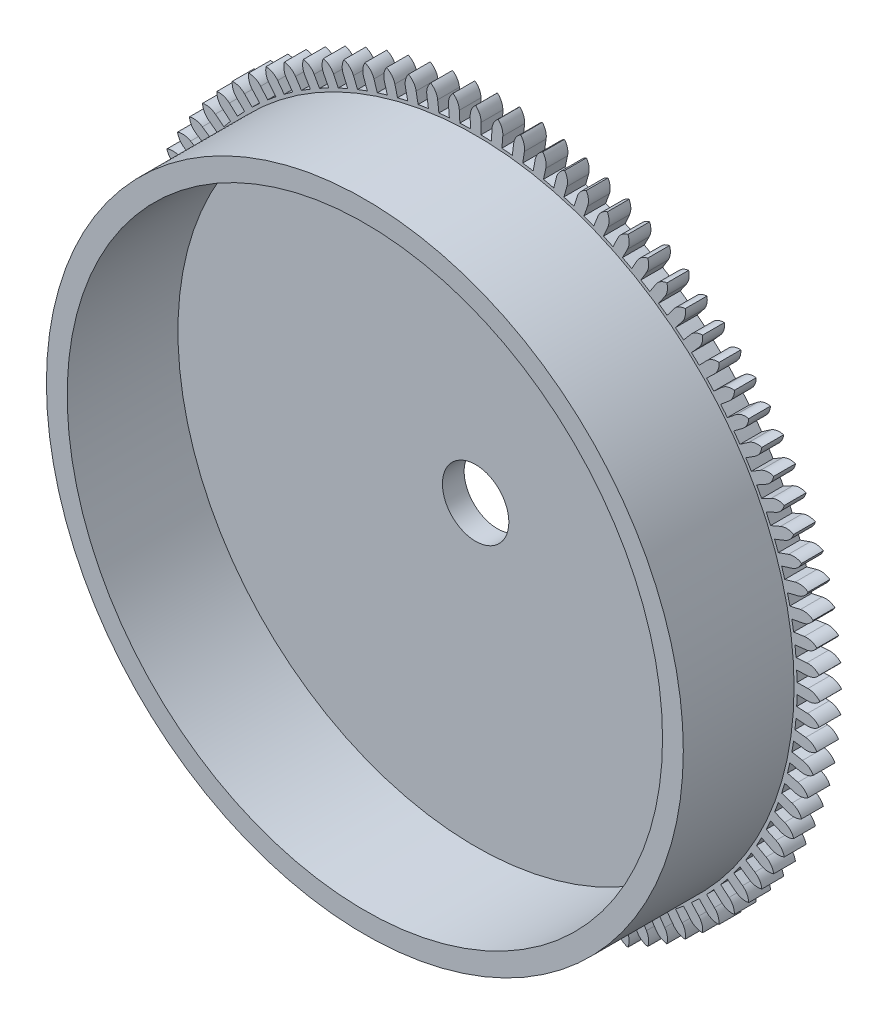
from build123d import *

# Parameters (mm, degrees)
SKETCH1_R           = 1.2
BOSS_EXTRUDE1_DEPTH = 0.7854
SKETCH1_4_R         = 11.5
SKETCH1_4_R_2       = 10.75
BOSS_EXTRUDE2_DEPTH = 4


with BuildPart() as part:
    # Sketch1 → Boss-Extrude1 (new body)
    with BuildSketch(Plane.XY):
        with BuildLine():
            Line((-0.196343429, 11.998393612), (-0.18991809, 11.605746181))
            ThreePointArc((-0.18991809, 11.605746181), (-0.37978021, 11.601085306), (-0.569540656, 11.593318625))
            Line((-0.569540656, 11.593318625), (-0.588809446, 11.985545604))
            ThreePointArc((-0.588809446, 11.985545604), (-0.653813053, 12.219949722), (-0.812993598, 12.403885345))
            ThreePointArc((-0.812993598, 12.403885345), (-0.946803915, 12.200746087), (-0.98065553, 11.959862655))
            Line((-0.98065553, 11.959862655), (-0.948563578, 11.56847615))
            ThreePointArc((-0.948563578, 11.56847615), (-1.137714353, 11.551407678), (-1.326560542, 11.531246698))
            Line((-1.326560542, 11.531246698), (-1.371440947, 11.921373651))
            ThreePointArc((-1.371440947, 11.921373651), (-1.45163614, 12.151024452), (-1.622505832, 12.324155349))
            ThreePointArc((-1.622505832, 12.324155349), (-1.742743708, 12.112699414), (-1.760768314, 11.870117731))
            Line((-1.760768314, 11.870117731), (-1.703147171, 11.481668128))
            ThreePointArc((-1.703147171, 11.481668128), (-1.890776628, 11.452265149), (-2.077899892, 11.419796203))
            Line((-2.077899892, 11.419796203), (-2.148199729, 11.806152545))
            ThreePointArc((-2.148199729, 11.806152545), (-2.243243098, 12.03006663), (-2.425070248, 12.191651428))
            ThreePointArc((-2.425070248, 12.191651428), (-2.531220805, 11.972784303), (-2.533341218, 11.72954314))
            Line((-2.533341218, 11.72954314), (-2.450437627, 11.345693841))
            ThreePointArc((-2.450437627, 11.345693841), (-2.635742308, 11.304082262), (-2.820341356, 11.259444388))
            Line((-2.820341356, 11.259444388), (-2.915759589, 11.640375682))
            ThreePointArc((-2.915759589, 11.640375682), (-3.025244144, 11.857594216), (-3.21725014, 12.006940984))
            ThreePointArc((-3.21725014, 12.006940984), (-3.308858826, 11.781599891), (-3.295065966, 11.538740845))
            Line((-3.295065966, 11.538740845), (-3.187234932, 11.161135551))
            ThreePointArc((-3.187234932, 11.161135551), (-3.369421334, 11.107493559), (-3.550705685, 11.050877903))
            Line((-3.550705685, 11.050877903), (-3.670833719, 11.424752943))
            ThreePointArc((-3.670833719, 11.424752943), (-3.794290631, 11.634345763), (-3.995653273, 11.770814975))
            ThreePointArc((-3.995653273, 11.770814975), (-4.072327806, 11.53996486), (-4.042680735, 11.29852789))
            Line((-4.042680735, 11.29852789), (-3.910384008, 10.928783564))
            ThreePointArc((-3.910384008, 10.928783564), (-4.088671981, 10.863340864), (-4.265865347, 10.794989862))
            Line((-4.265865347, 10.794989862), (-4.410188775, 11.160207658))
            ThreePointArc((-4.410188775, 11.160207658), (-4.547089383, 11.361277255), (-4.756946406, 11.484284529))
            ThreePointArc((-4.756946406, 11.484284529), (-4.818358452, 11.248913928), (-4.772984125, 11.009932903))
            Line((-4.772984125, 11.009932903), (-4.61678822, 10.649632849))
            ThreePointArc((-4.61678822, 10.649632849), (-4.790414307, 10.572669675), (-4.962757919, 10.492876018))
            Line((-4.962757919, 10.492876018), (-5.130658726, 10.84787265))
            ThreePointArc((-5.130658726, 10.84787265), (-5.2804168, 11.039558014), (-5.497869564, 11.148576614))
            ThreePointArc((-5.497869564, 11.148576614), (-5.543756148, 10.909693419), (-5.482848864, 10.674191694))
            Line((-5.482848864, 10.674191694), (-5.303422635, 10.324878771))
            ThreePointArc((-5.303422635, 10.324878771), (-5.471643343, 10.236724692), (-5.6383992, 10.145830067))
            Line((-5.6383992, 10.145830067), (-5.829158409, 10.489085387))
            ThreePointArc((-5.829158409, 10.489085387), (-5.991132662, 10.67056569), (-6.21525, 10.765128782))
            ThreePointArc((-6.21525, 10.765128782), (-6.245414629, 10.523755928), (-6.169235203, 10.292741958))
            Line((-6.169235203, 10.292741958), (-5.967346981, 9.955911977))
            ThreePointArc((-5.967346981, 9.955911977), (-6.129441963, 9.856944482), (-6.289895989, 9.755338115))
            Line((-6.289895989, 9.755338115), (-6.50269674, 10.085382249))
            ThreePointArc((-6.50269674, 10.085382249), (-6.676193574, 10.255880366), (-6.906015782, 10.335583016))
            ThreePointArc((-6.906015782, 10.335583016), (-6.920329286, 10.092754099), (-6.829203929, 9.86721712))
            Line((-6.829203929, 9.86721712), (-6.605718231, 9.54431244))
            ThreePointArc((-6.605718231, 9.54431244), (-6.760993371, 9.434955322), (-6.914458479, 9.323072307))
            Line((-6.914458479, 9.323072307), (-7.148389526, 9.638491956))
            ThreePointArc((-7.148389526, 9.638491956), (-7.332666, 9.797277788), (-7.567208943, 9.861778696))
            ThreePointArc((-7.567208943, 9.861778696), (-7.565610031, 9.618533547), (-7.459928956, 9.399439344))
            Line((-7.459928956, 9.399439344), (-7.215802781, 9.091842691))
            ThreePointArc((-7.215802781, 9.091842691), (-7.363593167, 8.972564235), (-7.509412195, 8.850883672))
            Line((-7.509412195, 8.850883672), (-7.76347181, 9.150328161))
            ThreePointArc((-7.76347181, 9.150328161), (-7.957738825, 9.296721762), (-8.195998155, 9.345744727))
            ThreePointArc((-8.195998155, 9.345744727), (-8.178493671, 9.103124958), (-8.058709421, 8.891411725))
            Line((-8.058709421, 8.891411725), (-7.794988156, 8.600440276))
            ThreePointArc((-7.794988156, 8.600440276), (-7.934660927, 8.471751251), (-8.072209456, 8.340794194))
            Line((-8.072209456, 8.340794194), (-8.345309716, 8.622981256))
            ThreePointArc((-8.345309716, 8.622981256), (-8.54873539, 8.756355747), (-8.789690844, 8.789690844))
            ThreePointArc((-8.789690844, 8.789690844), (-8.756355747, 8.54873539), (-8.622981256, 8.345309716))
            Line((-8.622981256, 8.345309716), (-8.340794194, 8.072209456))
            ThreePointArc((-8.340794194, 8.072209456), (-8.471751251, 7.934660927), (-8.600440276, 7.794988156))
            Line((-8.600440276, 7.794988156), (-8.891411725, 8.058709421))
            ThreePointArc((-8.891411725, 8.058709421), (-9.103124958, 8.178493671), (-9.345744727, 8.195998155))
            ThreePointArc((-9.345744727, 8.195998155), (-9.296721762, 7.957738825), (-9.150328161, 7.76347181))
            Line((-9.150328161, 7.76347181), (-8.850883672, 7.509412195))
            ThreePointArc((-8.850883672, 7.509412195), (-8.972564235, 7.363593167), (-9.091842691, 7.215802781))
            Line((-9.091842691, 7.215802781), (-9.399439344, 7.459928956))
            ThreePointArc((-9.399439344, 7.459928956), (-9.618533547, 7.565610031), (-9.861778696, 7.567208943))
            ThreePointArc((-9.861778696, 7.567208943), (-9.797277788, 7.332666), (-9.638491956, 7.148389526))
            Line((-9.638491956, 7.148389526), (-9.323072307, 6.914458479))
            ThreePointArc((-9.323072307, 6.914458479), (-9.434955322, 6.760993371), (-9.54431244, 6.605718231))
            Line((-9.54431244, 6.605718231), (-9.86721712, 6.829203929))
            ThreePointArc((-9.86721712, 6.829203929), (-10.092754099, 6.920329286), (-10.335583016, 6.906015782))
            ThreePointArc((-10.335583016, 6.906015782), (-10.255880366, 6.676193574), (-10.085382249, 6.50269674))
            Line((-10.085382249, 6.50269674), (-9.755338115, 6.289895989))
            ThreePointArc((-9.755338115, 6.289895989), (-9.856944482, 6.129441963), (-9.955911977, 5.967346981))
            Line((-9.955911977, 5.967346981), (-10.292741958, 6.169235203))
            ThreePointArc((-10.292741958, 6.169235203), (-10.523755928, 6.245414629), (-10.765128782, 6.21525))
            ThreePointArc((-10.765128782, 6.21525), (-10.67056569, 5.991132662), (-10.489085387, 5.829158409))
            Line((-10.489085387, 5.829158409), (-10.145830067, 5.6383992))
            ThreePointArc((-10.145830067, 5.6383992), (-10.236724692, 5.471643343), (-10.324878771, 5.303422635))
            Line((-10.324878771, 5.303422635), (-10.674191694, 5.482848864))
            ThreePointArc((-10.674191694, 5.482848864), (-10.909693419, 5.543756148), (-11.148576614, 5.497869564))
            ThreePointArc((-11.148576614, 5.497869564), (-11.039558014, 5.2804168), (-10.84787265, 5.130658726))
            Line((-10.84787265, 5.130658726), (-10.492876018, 4.962757919))
            ThreePointArc((-10.492876018, 4.962757919), (-10.572669675, 4.790414307), (-10.649632849, 4.61678822))
            Line((-10.649632849, 4.61678822), (-11.009932903, 4.772984125))
            ThreePointArc((-11.009932903, 4.772984125), (-11.248913928, 4.818358452), (-11.484284529, 4.756946406))
            ThreePointArc((-11.484284529, 4.756946406), (-11.361277255, 4.547089383), (-11.160207658, 4.410188775))
            Line((-11.160207658, 4.410188775), (-10.794989862, 4.265865347))
            ThreePointArc((-10.794989862, 4.265865347), (-10.863340864, 4.088671981), (-10.928783564, 3.910384008))
            Line((-10.928783564, 3.910384008), (-11.29852789, 4.042680735))
            ThreePointArc((-11.29852789, 4.042680735), (-11.53996486, 4.072327806), (-11.770814975, 3.995653273))
            ThreePointArc((-11.770814975, 3.995653273), (-11.634345763, 3.794290631), (-11.424752943, 3.670833719))
            Line((-11.424752943, 3.670833719), (-11.050877903, 3.550705685))
            ThreePointArc((-11.050877903, 3.550705685), (-11.107493559, 3.369421334), (-11.161135551, 3.187234932))
            Line((-11.161135551, 3.187234932), (-11.538740845, 3.295065966))
            ThreePointArc((-11.538740845, 3.295065966), (-11.781599891, 3.308858826), (-12.006940984, 3.21725014))
            ThreePointArc((-12.006940984, 3.21725014), (-11.857594216, 3.025244144), (-11.640375682, 2.915759589))
            Line((-11.640375682, 2.915759589), (-11.259444388, 2.820341356))
            ThreePointArc((-11.259444388, 2.820341356), (-11.304082262, 2.635742308), (-11.345693841, 2.450437627))
            Line((-11.345693841, 2.450437627), (-11.72954314, 2.533341218))
            ThreePointArc((-11.72954314, 2.533341218), (-11.972784303, 2.531220805), (-12.191651428, 2.425070248))
            ThreePointArc((-12.191651428, 2.425070248), (-12.03006663, 2.243243098), (-11.806152545, 2.148199729))
            Line((-11.806152545, 2.148199729), (-11.419796203, 2.077899892))
            ThreePointArc((-11.419796203, 2.077899892), (-11.452265149, 1.890776628), (-11.481668128, 1.703147171))
            Line((-11.481668128, 1.703147171), (-11.870117731, 1.760768314))
            ThreePointArc((-11.870117731, 1.760768314), (-12.112699414, 1.742743708), (-12.324155349, 1.622505832))
            ThreePointArc((-12.324155349, 1.622505832), (-12.151024452, 1.45163614), (-11.921373651, 1.371440947))
            Line((-11.921373651, 1.371440947), (-11.531246698, 1.326560542))
            ThreePointArc((-11.531246698, 1.326560542), (-11.551407678, 1.137714353), (-11.56847615, 0.948563578))
            Line((-11.56847615, 0.948563578), (-11.959862655, 0.98065553))
            ThreePointArc((-11.959862655, 0.98065553), (-12.200746087, 0.946803915), (-12.403885345, 0.812993598))
            ThreePointArc((-12.403885345, 0.812993598), (-12.219949722, 0.653813053), (-11.985545604, 0.588809446))
            Line((-11.985545604, 0.588809446), (-11.593318625, 0.569540656))
            ThreePointArc((-11.593318625, 0.569540656), (-11.601085306, 0.37978021), (-11.605746181, 0.18991809))
            Line((-11.605746181, 0.18991809), (-11.998393612, 0.196343429))
            ThreePointArc((-11.998393612, 0.196343429), (-12.236547292, 0.146809762), (-12.4305, 0))
            ThreePointArc((-12.4305, 0), (-12.236547292, -0.146809762), (-11.998393612, -0.196343429))
            Line((-11.998393612, -0.196343429), (-11.605746181, -0.18991809))
            ThreePointArc((-11.605746181, -0.18991809), (-11.601085306, -0.37978021), (-11.593318625, -0.569540656))
            Line((-11.593318625, -0.569540656), (-11.985545604, -0.588809446))
            ThreePointArc((-11.985545604, -0.588809446), (-12.219949722, -0.653813053), (-12.403885345, -0.812993598))
            ThreePointArc((-12.403885345, -0.812993598), (-12.200746087, -0.946803915), (-11.959862655, -0.98065553))
            Line((-11.959862655, -0.98065553), (-11.56847615, -0.948563578))
            ThreePointArc((-11.56847615, -0.948563578), (-11.551407678, -1.137714353), (-11.531246698, -1.326560542))
            Line((-11.531246698, -1.326560542), (-11.921373651, -1.371440947))
            ThreePointArc((-11.921373651, -1.371440947), (-12.151024452, -1.45163614), (-12.324155349, -1.622505832))
            ThreePointArc((-12.324155349, -1.622505832), (-12.112699414, -1.742743708), (-11.870117731, -1.760768314))
            Line((-11.870117731, -1.760768314), (-11.481668128, -1.703147171))
            ThreePointArc((-11.481668128, -1.703147171), (-11.452265149, -1.890776628), (-11.419796203, -2.077899892))
            Line((-11.419796203, -2.077899892), (-11.806152545, -2.148199729))
            ThreePointArc((-11.806152545, -2.148199729), (-12.03006663, -2.243243098), (-12.191651428, -2.425070248))
            ThreePointArc((-12.191651428, -2.425070248), (-11.972784303, -2.531220805), (-11.72954314, -2.533341218))
            Line((-11.72954314, -2.533341218), (-11.345693841, -2.450437627))
            ThreePointArc((-11.345693841, -2.450437627), (-11.304082262, -2.635742308), (-11.259444388, -2.820341356))
            Line((-11.259444388, -2.820341356), (-11.640375682, -2.915759589))
            ThreePointArc((-11.640375682, -2.915759589), (-11.857594216, -3.025244144), (-12.006940984, -3.21725014))
            ThreePointArc((-12.006940984, -3.21725014), (-11.781599891, -3.308858826), (-11.538740845, -3.295065966))
            Line((-11.538740845, -3.295065966), (-11.161135551, -3.187234932))
            ThreePointArc((-11.161135551, -3.187234932), (-11.107493559, -3.369421334), (-11.050877903, -3.550705685))
            Line((-11.050877903, -3.550705685), (-11.424752943, -3.670833719))
            ThreePointArc((-11.424752943, -3.670833719), (-11.634345763, -3.794290631), (-11.770814975, -3.995653273))
            ThreePointArc((-11.770814975, -3.995653273), (-11.53996486, -4.072327806), (-11.29852789, -4.042680735))
            Line((-11.29852789, -4.042680735), (-10.928783564, -3.910384008))
            ThreePointArc((-10.928783564, -3.910384008), (-10.863340864, -4.088671981), (-10.794989862, -4.265865347))
            Line((-10.794989862, -4.265865347), (-11.160207658, -4.410188775))
            ThreePointArc((-11.160207658, -4.410188775), (-11.361277255, -4.547089383), (-11.484284529, -4.756946406))
            ThreePointArc((-11.484284529, -4.756946406), (-11.248913928, -4.818358452), (-11.009932903, -4.772984125))
            Line((-11.009932903, -4.772984125), (-10.649632849, -4.61678822))
            ThreePointArc((-10.649632849, -4.61678822), (-10.572669675, -4.790414307), (-10.492876018, -4.962757919))
            Line((-10.492876018, -4.962757919), (-10.84787265, -5.130658726))
            ThreePointArc((-10.84787265, -5.130658726), (-11.039558014, -5.2804168), (-11.148576614, -5.497869564))
            ThreePointArc((-11.148576614, -5.497869564), (-10.909693419, -5.543756148), (-10.674191694, -5.482848864))
            Line((-10.674191694, -5.482848864), (-10.324878771, -5.303422635))
            ThreePointArc((-10.324878771, -5.303422635), (-10.236724692, -5.471643343), (-10.145830067, -5.6383992))
            Line((-10.145830067, -5.6383992), (-10.489085387, -5.829158409))
            ThreePointArc((-10.489085387, -5.829158409), (-10.67056569, -5.991132662), (-10.765128782, -6.21525))
            ThreePointArc((-10.765128782, -6.21525), (-10.523755928, -6.245414629), (-10.292741958, -6.169235203))
            Line((-10.292741958, -6.169235203), (-9.955911977, -5.967346981))
            ThreePointArc((-9.955911977, -5.967346981), (-9.856944482, -6.129441963), (-9.755338115, -6.289895989))
            Line((-9.755338115, -6.289895989), (-10.085382249, -6.50269674))
            ThreePointArc((-10.085382249, -6.50269674), (-10.255880366, -6.676193574), (-10.335583016, -6.906015782))
            ThreePointArc((-10.335583016, -6.906015782), (-10.092754099, -6.920329286), (-9.86721712, -6.829203929))
            Line((-9.86721712, -6.829203929), (-9.54431244, -6.605718231))
            ThreePointArc((-9.54431244, -6.605718231), (-9.434955322, -6.760993371), (-9.323072307, -6.914458479))
            Line((-9.323072307, -6.914458479), (-9.638491956, -7.148389526))
            ThreePointArc((-9.638491956, -7.148389526), (-9.797277788, -7.332666), (-9.861778696, -7.567208943))
            ThreePointArc((-9.861778696, -7.567208943), (-9.618533547, -7.565610031), (-9.399439344, -7.459928956))
            Line((-9.399439344, -7.459928956), (-9.091842691, -7.215802781))
            ThreePointArc((-9.091842691, -7.215802781), (-8.972564235, -7.363593167), (-8.850883672, -7.509412195))
            Line((-8.850883672, -7.509412195), (-9.150328161, -7.76347181))
            ThreePointArc((-9.150328161, -7.76347181), (-9.296721762, -7.957738825), (-9.345744727, -8.195998155))
            ThreePointArc((-9.345744727, -8.195998155), (-9.103124958, -8.178493671), (-8.891411725, -8.058709421))
            Line((-8.891411725, -8.058709421), (-8.600440276, -7.794988156))
            ThreePointArc((-8.600440276, -7.794988156), (-8.471751251, -7.934660927), (-8.340794194, -8.072209456))
            Line((-8.340794194, -8.072209456), (-8.622981256, -8.345309716))
            ThreePointArc((-8.622981256, -8.345309716), (-8.756355747, -8.54873539), (-8.789690844, -8.789690844))
            ThreePointArc((-8.789690844, -8.789690844), (-8.54873539, -8.756355747), (-8.345309716, -8.622981256))
            Line((-8.345309716, -8.622981256), (-8.072209456, -8.340794194))
            ThreePointArc((-8.072209456, -8.340794194), (-7.934660927, -8.471751251), (-7.794988156, -8.600440276))
            Line((-7.794988156, -8.600440276), (-8.058709421, -8.891411725))
            ThreePointArc((-8.058709421, -8.891411725), (-8.178493671, -9.103124958), (-8.195998155, -9.345744727))
            ThreePointArc((-8.195998155, -9.345744727), (-7.957738825, -9.296721762), (-7.76347181, -9.150328161))
            Line((-7.76347181, -9.150328161), (-7.509412195, -8.850883672))
            ThreePointArc((-7.509412195, -8.850883672), (-7.363593167, -8.972564235), (-7.215802781, -9.091842691))
            Line((-7.215802781, -9.091842691), (-7.459928956, -9.399439344))
            ThreePointArc((-7.459928956, -9.399439344), (-7.565610031, -9.618533547), (-7.567208943, -9.861778696))
            ThreePointArc((-7.567208943, -9.861778696), (-7.332666, -9.797277788), (-7.148389526, -9.638491956))
            Line((-7.148389526, -9.638491956), (-6.914458479, -9.323072307))
            ThreePointArc((-6.914458479, -9.323072307), (-6.760993371, -9.434955322), (-6.605718231, -9.54431244))
            Line((-6.605718231, -9.54431244), (-6.829203929, -9.86721712))
            ThreePointArc((-6.829203929, -9.86721712), (-6.920329286, -10.092754099), (-6.906015782, -10.335583016))
            ThreePointArc((-6.906015782, -10.335583016), (-6.676193574, -10.255880366), (-6.50269674, -10.085382249))
            Line((-6.50269674, -10.085382249), (-6.289895989, -9.755338115))
            ThreePointArc((-6.289895989, -9.755338115), (-6.129441963, -9.856944482), (-5.967346981, -9.955911977))
            Line((-5.967346981, -9.955911977), (-6.169235203, -10.292741958))
            ThreePointArc((-6.169235203, -10.292741958), (-6.245414629, -10.523755928), (-6.21525, -10.765128782))
            ThreePointArc((-6.21525, -10.765128782), (-5.991132662, -10.67056569), (-5.829158409, -10.489085387))
            Line((-5.829158409, -10.489085387), (-5.6383992, -10.145830067))
            ThreePointArc((-5.6383992, -10.145830067), (-5.471643343, -10.236724692), (-5.303422635, -10.324878771))
            Line((-5.303422635, -10.324878771), (-5.482848864, -10.674191694))
            ThreePointArc((-5.482848864, -10.674191694), (-5.543756148, -10.909693419), (-5.497869564, -11.148576614))
            ThreePointArc((-5.497869564, -11.148576614), (-5.2804168, -11.039558014), (-5.130658726, -10.84787265))
            Line((-5.130658726, -10.84787265), (-4.962757919, -10.492876018))
            ThreePointArc((-4.962757919, -10.492876018), (-4.790414307, -10.572669675), (-4.61678822, -10.649632849))
            Line((-4.61678822, -10.649632849), (-4.772984125, -11.009932903))
            ThreePointArc((-4.772984125, -11.009932903), (-4.818358452, -11.248913928), (-4.756946406, -11.484284529))
            ThreePointArc((-4.756946406, -11.484284529), (-4.547089383, -11.361277255), (-4.410188775, -11.160207658))
            Line((-4.410188775, -11.160207658), (-4.265865347, -10.794989862))
            ThreePointArc((-4.265865347, -10.794989862), (-4.088671981, -10.863340864), (-3.910384008, -10.928783564))
            Line((-3.910384008, -10.928783564), (-4.042680735, -11.29852789))
            ThreePointArc((-4.042680735, -11.29852789), (-4.072327806, -11.53996486), (-3.995653273, -11.770814975))
            ThreePointArc((-3.995653273, -11.770814975), (-3.794290631, -11.634345763), (-3.670833719, -11.424752943))
            Line((-3.670833719, -11.424752943), (-3.550705685, -11.050877903))
            ThreePointArc((-3.550705685, -11.050877903), (-3.369421334, -11.107493559), (-3.187234932, -11.161135551))
            Line((-3.187234932, -11.161135551), (-3.295065966, -11.538740845))
            ThreePointArc((-3.295065966, -11.538740845), (-3.308858826, -11.781599891), (-3.21725014, -12.006940984))
            ThreePointArc((-3.21725014, -12.006940984), (-3.025244144, -11.857594216), (-2.915759589, -11.640375682))
            Line((-2.915759589, -11.640375682), (-2.820341356, -11.259444388))
            ThreePointArc((-2.820341356, -11.259444388), (-2.635742308, -11.304082262), (-2.450437627, -11.345693841))
            Line((-2.450437627, -11.345693841), (-2.533341218, -11.72954314))
            ThreePointArc((-2.533341218, -11.72954314), (-2.531220805, -11.972784303), (-2.425070248, -12.191651428))
            ThreePointArc((-2.425070248, -12.191651428), (-2.243243098, -12.03006663), (-2.148199729, -11.806152545))
            Line((-2.148199729, -11.806152545), (-2.077899892, -11.419796203))
            ThreePointArc((-2.077899892, -11.419796203), (-1.890776628, -11.452265149), (-1.703147171, -11.481668128))
            Line((-1.703147171, -11.481668128), (-1.760768314, -11.870117731))
            ThreePointArc((-1.760768314, -11.870117731), (-1.742743708, -12.112699414), (-1.622505832, -12.324155349))
            ThreePointArc((-1.622505832, -12.324155349), (-1.45163614, -12.151024452), (-1.371440947, -11.921373651))
            Line((-1.371440947, -11.921373651), (-1.326560542, -11.531246698))
            ThreePointArc((-1.326560542, -11.531246698), (-1.137714353, -11.551407678), (-0.948563578, -11.56847615))
            Line((-0.948563578, -11.56847615), (-0.98065553, -11.959862655))
            ThreePointArc((-0.98065553, -11.959862655), (-0.946803915, -12.200746087), (-0.812993598, -12.403885345))
            ThreePointArc((-0.812993598, -12.403885345), (-0.653813053, -12.219949722), (-0.588809446, -11.985545604))
            Line((-0.588809446, -11.985545604), (-0.569540656, -11.593318625))
            ThreePointArc((-0.569540656, -11.593318625), (-0.37978021, -11.601085306), (-0.18991809, -11.605746181))
            Line((-0.18991809, -11.605746181), (-0.196343429, -11.998393612))
            ThreePointArc((-0.196343429, -11.998393612), (-0.146809762, -12.236547292), (0, -12.4305))
            ThreePointArc((0, -12.4305), (0.146809762, -12.236547292), (0.196343429, -11.998393612))
            Line((0.196343429, -11.998393612), (0.18991809, -11.605746181))
            ThreePointArc((0.18991809, -11.605746181), (0.37978021, -11.601085306), (0.569540656, -11.593318625))
            Line((0.569540656, -11.593318625), (0.588809446, -11.985545604))
            ThreePointArc((0.588809446, -11.985545604), (0.653813053, -12.219949722), (0.812993598, -12.403885345))
            ThreePointArc((0.812993598, -12.403885345), (0.946803915, -12.200746087), (0.98065553, -11.959862655))
            Line((0.98065553, -11.959862655), (0.948563578, -11.56847615))
            ThreePointArc((0.948563578, -11.56847615), (1.137714353, -11.551407678), (1.326560542, -11.531246698))
            Line((1.326560542, -11.531246698), (1.371440947, -11.921373651))
            ThreePointArc((1.371440947, -11.921373651), (1.45163614, -12.151024452), (1.622505832, -12.324155349))
            ThreePointArc((1.622505832, -12.324155349), (1.742743708, -12.112699414), (1.760768314, -11.870117731))
            Line((1.760768314, -11.870117731), (1.703147171, -11.481668128))
            ThreePointArc((1.703147171, -11.481668128), (1.890776628, -11.452265149), (2.077899892, -11.419796203))
            Line((2.077899892, -11.419796203), (2.148199729, -11.806152545))
            ThreePointArc((2.148199729, -11.806152545), (2.243243098, -12.03006663), (2.425070248, -12.191651428))
            ThreePointArc((2.425070248, -12.191651428), (2.531220805, -11.972784303), (2.533341218, -11.72954314))
            Line((2.533341218, -11.72954314), (2.450437627, -11.345693841))
            ThreePointArc((2.450437627, -11.345693841), (2.635742308, -11.304082262), (2.820341356, -11.259444388))
            Line((2.820341356, -11.259444388), (2.915759589, -11.640375682))
            ThreePointArc((2.915759589, -11.640375682), (3.025244144, -11.857594216), (3.21725014, -12.006940984))
            ThreePointArc((3.21725014, -12.006940984), (3.308858826, -11.781599891), (3.295065966, -11.538740845))
            Line((3.295065966, -11.538740845), (3.187234932, -11.161135551))
            ThreePointArc((3.187234932, -11.161135551), (3.369421334, -11.107493559), (3.550705685, -11.050877903))
            Line((3.550705685, -11.050877903), (3.670833719, -11.424752943))
            ThreePointArc((3.670833719, -11.424752943), (3.794290631, -11.634345763), (3.995653273, -11.770814975))
            ThreePointArc((3.995653273, -11.770814975), (4.072327806, -11.53996486), (4.042680735, -11.29852789))
            Line((4.042680735, -11.29852789), (3.910384008, -10.928783564))
            ThreePointArc((3.910384008, -10.928783564), (4.088671981, -10.863340864), (4.265865347, -10.794989862))
            Line((4.265865347, -10.794989862), (4.410188775, -11.160207658))
            ThreePointArc((4.410188775, -11.160207658), (4.547089383, -11.361277255), (4.756946406, -11.484284529))
            ThreePointArc((4.756946406, -11.484284529), (4.818358452, -11.248913928), (4.772984125, -11.009932903))
            Line((4.772984125, -11.009932903), (4.61678822, -10.649632849))
            ThreePointArc((4.61678822, -10.649632849), (4.790414307, -10.572669675), (4.962757919, -10.492876018))
            Line((4.962757919, -10.492876018), (5.130658726, -10.84787265))
            ThreePointArc((5.130658726, -10.84787265), (5.2804168, -11.039558014), (5.497869564, -11.148576614))
            ThreePointArc((5.497869564, -11.148576614), (5.543756148, -10.909693419), (5.482848864, -10.674191694))
            Line((5.482848864, -10.674191694), (5.303422635, -10.324878771))
            ThreePointArc((5.303422635, -10.324878771), (5.471643343, -10.236724692), (5.6383992, -10.145830067))
            Line((5.6383992, -10.145830067), (5.829158409, -10.489085387))
            ThreePointArc((5.829158409, -10.489085387), (5.991132662, -10.67056569), (6.21525, -10.765128782))
            ThreePointArc((6.21525, -10.765128782), (6.245414629, -10.523755928), (6.169235203, -10.292741958))
            Line((6.169235203, -10.292741958), (5.967346981, -9.955911977))
            ThreePointArc((5.967346981, -9.955911977), (6.129441963, -9.856944482), (6.289895989, -9.755338115))
            Line((6.289895989, -9.755338115), (6.50269674, -10.085382249))
            ThreePointArc((6.50269674, -10.085382249), (6.676193574, -10.255880366), (6.906015782, -10.335583016))
            ThreePointArc((6.906015782, -10.335583016), (6.920329286, -10.092754099), (6.829203929, -9.86721712))
            Line((6.829203929, -9.86721712), (6.605718231, -9.54431244))
            ThreePointArc((6.605718231, -9.54431244), (6.760993371, -9.434955322), (6.914458479, -9.323072307))
            Line((6.914458479, -9.323072307), (7.148389526, -9.638491956))
            ThreePointArc((7.148389526, -9.638491956), (7.332666, -9.797277788), (7.567208943, -9.861778696))
            ThreePointArc((7.567208943, -9.861778696), (7.565610031, -9.618533547), (7.459928956, -9.399439344))
            Line((7.459928956, -9.399439344), (7.215802781, -9.091842691))
            ThreePointArc((7.215802781, -9.091842691), (7.363593167, -8.972564235), (7.509412195, -8.850883672))
            Line((7.509412195, -8.850883672), (7.76347181, -9.150328161))
            ThreePointArc((7.76347181, -9.150328161), (7.957738825, -9.296721762), (8.195998155, -9.345744727))
            ThreePointArc((8.195998155, -9.345744727), (8.178493671, -9.103124958), (8.058709421, -8.891411725))
            Line((8.058709421, -8.891411725), (7.794988156, -8.600440276))
            ThreePointArc((7.794988156, -8.600440276), (7.934660927, -8.471751251), (8.072209456, -8.340794194))
            Line((8.072209456, -8.340794194), (8.345309716, -8.622981256))
            ThreePointArc((8.345309716, -8.622981256), (8.54873539, -8.756355747), (8.789690844, -8.789690844))
            ThreePointArc((8.789690844, -8.789690844), (8.756355747, -8.54873539), (8.622981256, -8.345309716))
            Line((8.622981256, -8.345309716), (8.340794194, -8.072209456))
            ThreePointArc((8.340794194, -8.072209456), (8.471751251, -7.934660927), (8.600440276, -7.794988156))
            Line((8.600440276, -7.794988156), (8.891411725, -8.058709421))
            ThreePointArc((8.891411725, -8.058709421), (9.103124958, -8.178493671), (9.345744727, -8.195998155))
            ThreePointArc((9.345744727, -8.195998155), (9.296721762, -7.957738825), (9.150328161, -7.76347181))
            Line((9.150328161, -7.76347181), (8.850883672, -7.509412195))
            ThreePointArc((8.850883672, -7.509412195), (8.972564235, -7.363593167), (9.091842691, -7.215802781))
            Line((9.091842691, -7.215802781), (9.399439344, -7.459928956))
            ThreePointArc((9.399439344, -7.459928956), (9.618533547, -7.565610031), (9.861778696, -7.567208943))
            ThreePointArc((9.861778696, -7.567208943), (9.797277788, -7.332666), (9.638491956, -7.148389526))
            Line((9.638491956, -7.148389526), (9.323072307, -6.914458479))
            ThreePointArc((9.323072307, -6.914458479), (9.434955322, -6.760993371), (9.54431244, -6.605718231))
            Line((9.54431244, -6.605718231), (9.86721712, -6.829203929))
            ThreePointArc((9.86721712, -6.829203929), (10.092754099, -6.920329286), (10.335583016, -6.906015782))
            ThreePointArc((10.335583016, -6.906015782), (10.255880366, -6.676193574), (10.085382249, -6.50269674))
            Line((10.085382249, -6.50269674), (9.755338115, -6.289895989))
            ThreePointArc((9.755338115, -6.289895989), (9.856944482, -6.129441963), (9.955911977, -5.967346981))
            Line((9.955911977, -5.967346981), (10.292741958, -6.169235203))
            ThreePointArc((10.292741958, -6.169235203), (10.523755928, -6.245414629), (10.765128782, -6.21525))
            ThreePointArc((10.765128782, -6.21525), (10.67056569, -5.991132662), (10.489085387, -5.829158409))
            Line((10.489085387, -5.829158409), (10.145830067, -5.6383992))
            ThreePointArc((10.145830067, -5.6383992), (10.236724692, -5.471643343), (10.324878771, -5.303422635))
            Line((10.324878771, -5.303422635), (10.674191694, -5.482848864))
            ThreePointArc((10.674191694, -5.482848864), (10.909693419, -5.543756148), (11.148576614, -5.497869564))
            ThreePointArc((11.148576614, -5.497869564), (11.039558014, -5.2804168), (10.84787265, -5.130658726))
            Line((10.84787265, -5.130658726), (10.492876018, -4.962757919))
            ThreePointArc((10.492876018, -4.962757919), (10.572669675, -4.790414307), (10.649632849, -4.61678822))
            Line((10.649632849, -4.61678822), (11.009932903, -4.772984125))
            ThreePointArc((11.009932903, -4.772984125), (11.248913928, -4.818358452), (11.484284529, -4.756946406))
            ThreePointArc((11.484284529, -4.756946406), (11.361277255, -4.547089383), (11.160207658, -4.410188775))
            Line((11.160207658, -4.410188775), (10.794989862, -4.265865347))
            ThreePointArc((10.794989862, -4.265865347), (10.863340864, -4.088671981), (10.928783564, -3.910384008))
            Line((10.928783564, -3.910384008), (11.29852789, -4.042680735))
            ThreePointArc((11.29852789, -4.042680735), (11.53996486, -4.072327806), (11.770814975, -3.995653273))
            ThreePointArc((11.770814975, -3.995653273), (11.634345763, -3.794290631), (11.424752943, -3.670833719))
            Line((11.424752943, -3.670833719), (11.050877903, -3.550705685))
            ThreePointArc((11.050877903, -3.550705685), (11.107493559, -3.369421334), (11.161135551, -3.187234932))
            Line((11.161135551, -3.187234932), (11.538740845, -3.295065966))
            ThreePointArc((11.538740845, -3.295065966), (11.781599891, -3.308858826), (12.006940984, -3.21725014))
            ThreePointArc((12.006940984, -3.21725014), (11.857594216, -3.025244144), (11.640375682, -2.915759589))
            Line((11.640375682, -2.915759589), (11.259444388, -2.820341356))
            ThreePointArc((11.259444388, -2.820341356), (11.304082262, -2.635742308), (11.345693841, -2.450437627))
            Line((11.345693841, -2.450437627), (11.72954314, -2.533341218))
            ThreePointArc((11.72954314, -2.533341218), (11.972784303, -2.531220805), (12.191651428, -2.425070248))
            ThreePointArc((12.191651428, -2.425070248), (12.03006663, -2.243243098), (11.806152545, -2.148199729))
            Line((11.806152545, -2.148199729), (11.419796203, -2.077899892))
            ThreePointArc((11.419796203, -2.077899892), (11.452265149, -1.890776628), (11.481668128, -1.703147171))
            Line((11.481668128, -1.703147171), (11.870117731, -1.760768314))
            ThreePointArc((11.870117731, -1.760768314), (12.112699414, -1.742743708), (12.324155349, -1.622505832))
            ThreePointArc((12.324155349, -1.622505832), (12.151024452, -1.45163614), (11.921373651, -1.371440947))
            Line((11.921373651, -1.371440947), (11.531246698, -1.326560542))
            ThreePointArc((11.531246698, -1.326560542), (11.551407678, -1.137714353), (11.56847615, -0.948563578))
            Line((11.56847615, -0.948563578), (11.959862655, -0.98065553))
            ThreePointArc((11.959862655, -0.98065553), (12.200746087, -0.946803915), (12.403885345, -0.812993598))
            ThreePointArc((12.403885345, -0.812993598), (12.219949722, -0.653813053), (11.985545604, -0.588809446))
            Line((11.985545604, -0.588809446), (11.593318625, -0.569540656))
            ThreePointArc((11.593318625, -0.569540656), (11.601085306, -0.37978021), (11.605746181, -0.18991809))
            Line((11.605746181, -0.18991809), (11.998393612, -0.196343429))
            ThreePointArc((11.998393612, -0.196343429), (12.236547292, -0.146809762), (12.4305, 0))
            ThreePointArc((12.4305, 0), (12.236547292, 0.146809762), (11.998393612, 0.196343429))
            Line((11.998393612, 0.196343429), (11.605746181, 0.18991809))
            ThreePointArc((11.605746181, 0.18991809), (11.601085306, 0.37978021), (11.593318625, 0.569540656))
            Line((11.593318625, 0.569540656), (11.985545604, 0.588809446))
            ThreePointArc((11.985545604, 0.588809446), (12.219949722, 0.653813053), (12.403885345, 0.812993598))
            ThreePointArc((12.403885345, 0.812993598), (12.200746087, 0.946803915), (11.959862655, 0.98065553))
            Line((11.959862655, 0.98065553), (11.56847615, 0.948563578))
            ThreePointArc((11.56847615, 0.948563578), (11.551407678, 1.137714353), (11.531246698, 1.326560542))
            Line((11.531246698, 1.326560542), (11.921373651, 1.371440947))
            ThreePointArc((11.921373651, 1.371440947), (12.151024452, 1.45163614), (12.324155349, 1.622505832))
            ThreePointArc((12.324155349, 1.622505832), (12.112699414, 1.742743708), (11.870117731, 1.760768314))
            Line((11.870117731, 1.760768314), (11.481668128, 1.703147171))
            ThreePointArc((11.481668128, 1.703147171), (11.452265149, 1.890776628), (11.419796203, 2.077899892))
            Line((11.419796203, 2.077899892), (11.806152545, 2.148199729))
            ThreePointArc((11.806152545, 2.148199729), (12.03006663, 2.243243098), (12.191651428, 2.425070248))
            ThreePointArc((12.191651428, 2.425070248), (11.972784303, 2.531220805), (11.72954314, 2.533341218))
            Line((11.72954314, 2.533341218), (11.345693841, 2.450437627))
            ThreePointArc((11.345693841, 2.450437627), (11.304082262, 2.635742308), (11.259444388, 2.820341356))
            Line((11.259444388, 2.820341356), (11.640375682, 2.915759589))
            ThreePointArc((11.640375682, 2.915759589), (11.857594216, 3.025244144), (12.006940984, 3.21725014))
            ThreePointArc((12.006940984, 3.21725014), (11.781599891, 3.308858826), (11.538740845, 3.295065966))
            Line((11.538740845, 3.295065966), (11.161135551, 3.187234932))
            ThreePointArc((11.161135551, 3.187234932), (11.107493559, 3.369421334), (11.050877903, 3.550705685))
            Line((11.050877903, 3.550705685), (11.424752943, 3.670833719))
            ThreePointArc((11.424752943, 3.670833719), (11.634345763, 3.794290631), (11.770814975, 3.995653273))
            ThreePointArc((11.770814975, 3.995653273), (11.53996486, 4.072327806), (11.29852789, 4.042680735))
            Line((11.29852789, 4.042680735), (10.928783564, 3.910384008))
            ThreePointArc((10.928783564, 3.910384008), (10.863340864, 4.088671981), (10.794989862, 4.265865347))
            Line((10.794989862, 4.265865347), (11.160207658, 4.410188775))
            ThreePointArc((11.160207658, 4.410188775), (11.361277255, 4.547089383), (11.484284529, 4.756946406))
            ThreePointArc((11.484284529, 4.756946406), (11.248913928, 4.818358452), (11.009932903, 4.772984125))
            Line((11.009932903, 4.772984125), (10.649632849, 4.61678822))
            ThreePointArc((10.649632849, 4.61678822), (10.572669675, 4.790414307), (10.492876018, 4.962757919))
            Line((10.492876018, 4.962757919), (10.84787265, 5.130658726))
            ThreePointArc((10.84787265, 5.130658726), (11.039558014, 5.2804168), (11.148576614, 5.497869564))
            ThreePointArc((11.148576614, 5.497869564), (10.909693419, 5.543756148), (10.674191694, 5.482848864))
            Line((10.674191694, 5.482848864), (10.324878771, 5.303422635))
            ThreePointArc((10.324878771, 5.303422635), (10.236724692, 5.471643343), (10.145830067, 5.6383992))
            Line((10.145830067, 5.6383992), (10.489085387, 5.829158409))
            ThreePointArc((10.489085387, 5.829158409), (10.67056569, 5.991132662), (10.765128782, 6.21525))
            ThreePointArc((10.765128782, 6.21525), (10.523755928, 6.245414629), (10.292741958, 6.169235203))
            Line((10.292741958, 6.169235203), (9.955911977, 5.967346981))
            ThreePointArc((9.955911977, 5.967346981), (9.856944482, 6.129441963), (9.755338115, 6.289895989))
            Line((9.755338115, 6.289895989), (10.085382249, 6.50269674))
            ThreePointArc((10.085382249, 6.50269674), (10.255880366, 6.676193574), (10.335583016, 6.906015782))
            ThreePointArc((10.335583016, 6.906015782), (10.092754099, 6.920329286), (9.86721712, 6.829203929))
            Line((9.86721712, 6.829203929), (9.54431244, 6.605718231))
            ThreePointArc((9.54431244, 6.605718231), (9.434955322, 6.760993371), (9.323072307, 6.914458479))
            Line((9.323072307, 6.914458479), (9.638491956, 7.148389526))
            ThreePointArc((9.638491956, 7.148389526), (9.797277788, 7.332666), (9.861778696, 7.567208943))
            ThreePointArc((9.861778696, 7.567208943), (9.618533547, 7.565610031), (9.399439344, 7.459928956))
            Line((9.399439344, 7.459928956), (9.091842691, 7.215802781))
            ThreePointArc((9.091842691, 7.215802781), (8.972564235, 7.363593167), (8.850883672, 7.509412195))
            Line((8.850883672, 7.509412195), (9.150328161, 7.76347181))
            ThreePointArc((9.150328161, 7.76347181), (9.296721762, 7.957738825), (9.345744727, 8.195998155))
            ThreePointArc((9.345744727, 8.195998155), (9.103124958, 8.178493671), (8.891411725, 8.058709421))
            Line((8.891411725, 8.058709421), (8.600440276, 7.794988156))
            ThreePointArc((8.600440276, 7.794988156), (8.471751251, 7.934660927), (8.340794194, 8.072209456))
            Line((8.340794194, 8.072209456), (8.622981256, 8.345309716))
            ThreePointArc((8.622981256, 8.345309716), (8.756355747, 8.54873539), (8.789690844, 8.789690844))
            ThreePointArc((8.789690844, 8.789690844), (8.54873539, 8.756355747), (8.345309716, 8.622981256))
            Line((8.345309716, 8.622981256), (8.072209456, 8.340794194))
            ThreePointArc((8.072209456, 8.340794194), (7.934660927, 8.471751251), (7.794988156, 8.600440276))
            Line((7.794988156, 8.600440276), (8.058709421, 8.891411725))
            ThreePointArc((8.058709421, 8.891411725), (8.178493671, 9.103124958), (8.195998155, 9.345744727))
            ThreePointArc((8.195998155, 9.345744727), (7.957738825, 9.296721762), (7.76347181, 9.150328161))
            Line((7.76347181, 9.150328161), (7.509412195, 8.850883672))
            ThreePointArc((7.509412195, 8.850883672), (7.363593167, 8.972564235), (7.215802781, 9.091842691))
            Line((7.215802781, 9.091842691), (7.459928956, 9.399439344))
            ThreePointArc((7.459928956, 9.399439344), (7.565610031, 9.618533547), (7.567208943, 9.861778696))
            ThreePointArc((7.567208943, 9.861778696), (7.332666, 9.797277788), (7.148389526, 9.638491956))
            Line((7.148389526, 9.638491956), (6.914458479, 9.323072307))
            ThreePointArc((6.914458479, 9.323072307), (6.760993371, 9.434955322), (6.605718231, 9.54431244))
            Line((6.605718231, 9.54431244), (6.829203929, 9.86721712))
            ThreePointArc((6.829203929, 9.86721712), (6.920329286, 10.092754099), (6.906015782, 10.335583016))
            ThreePointArc((6.906015782, 10.335583016), (6.676193574, 10.255880366), (6.50269674, 10.085382249))
            Line((6.50269674, 10.085382249), (6.289895989, 9.755338115))
            ThreePointArc((6.289895989, 9.755338115), (6.129441963, 9.856944482), (5.967346981, 9.955911977))
            Line((5.967346981, 9.955911977), (6.169235203, 10.292741958))
            ThreePointArc((6.169235203, 10.292741958), (6.245414629, 10.523755928), (6.21525, 10.765128782))
            ThreePointArc((6.21525, 10.765128782), (5.991132662, 10.67056569), (5.829158409, 10.489085387))
            Line((5.829158409, 10.489085387), (5.6383992, 10.145830067))
            ThreePointArc((5.6383992, 10.145830067), (5.471643343, 10.236724692), (5.303422635, 10.324878771))
            Line((5.303422635, 10.324878771), (5.482848864, 10.674191694))
            ThreePointArc((5.482848864, 10.674191694), (5.543756148, 10.909693419), (5.497869564, 11.148576614))
            ThreePointArc((5.497869564, 11.148576614), (5.2804168, 11.039558014), (5.130658726, 10.84787265))
            Line((5.130658726, 10.84787265), (4.962757919, 10.492876018))
            ThreePointArc((4.962757919, 10.492876018), (4.790414307, 10.572669675), (4.61678822, 10.649632849))
            Line((4.61678822, 10.649632849), (4.772984125, 11.009932903))
            ThreePointArc((4.772984125, 11.009932903), (4.818358452, 11.248913928), (4.756946406, 11.484284529))
            ThreePointArc((4.756946406, 11.484284529), (4.547089383, 11.361277255), (4.410188775, 11.160207658))
            Line((4.410188775, 11.160207658), (4.265865347, 10.794989862))
            ThreePointArc((4.265865347, 10.794989862), (4.088671981, 10.863340864), (3.910384008, 10.928783564))
            Line((3.910384008, 10.928783564), (4.042680735, 11.29852789))
            ThreePointArc((4.042680735, 11.29852789), (4.072327806, 11.53996486), (3.995653273, 11.770814975))
            ThreePointArc((3.995653273, 11.770814975), (3.794290631, 11.634345763), (3.670833719, 11.424752943))
            Line((3.670833719, 11.424752943), (3.550705685, 11.050877903))
            ThreePointArc((3.550705685, 11.050877903), (3.369421334, 11.107493559), (3.187234932, 11.161135551))
            Line((3.187234932, 11.161135551), (3.295065966, 11.538740845))
            ThreePointArc((3.295065966, 11.538740845), (3.308858826, 11.781599891), (3.21725014, 12.006940984))
            ThreePointArc((3.21725014, 12.006940984), (3.025244144, 11.857594216), (2.915759589, 11.640375682))
            Line((2.915759589, 11.640375682), (2.820341356, 11.259444388))
            ThreePointArc((2.820341356, 11.259444388), (2.635742308, 11.304082262), (2.450437627, 11.345693841))
            Line((2.450437627, 11.345693841), (2.533341218, 11.72954314))
            ThreePointArc((2.533341218, 11.72954314), (2.531220805, 11.972784303), (2.425070248, 12.191651428))
            ThreePointArc((2.425070248, 12.191651428), (2.243243098, 12.03006663), (2.148199729, 11.806152545))
            Line((2.148199729, 11.806152545), (2.077899892, 11.419796203))
            ThreePointArc((2.077899892, 11.419796203), (1.890776628, 11.452265149), (1.703147171, 11.481668128))
            Line((1.703147171, 11.481668128), (1.760768314, 11.870117731))
            ThreePointArc((1.760768314, 11.870117731), (1.742743708, 12.112699414), (1.622505832, 12.324155349))
            ThreePointArc((1.622505832, 12.324155349), (1.45163614, 12.151024452), (1.371440947, 11.921373651))
            Line((1.371440947, 11.921373651), (1.326560542, 11.531246698))
            ThreePointArc((1.326560542, 11.531246698), (1.137714353, 11.551407678), (0.948563578, 11.56847615))
            Line((0.948563578, 11.56847615), (0.98065553, 11.959862655))
            ThreePointArc((0.98065553, 11.959862655), (0.946803915, 12.200746087), (0.812993598, 12.403885345))
            ThreePointArc((0.812993598, 12.403885345), (0.653813053, 12.219949722), (0.588809446, 11.985545604))
            Line((0.588809446, 11.985545604), (0.569540656, 11.593318625))
            ThreePointArc((0.569540656, 11.593318625), (0.37978021, 11.601085306), (0.18991809, 11.605746181))
            Line((0.18991809, 11.605746181), (0.196343429, 11.998393612))
            ThreePointArc((0.196343429, 11.998393612), (0.146809762, 12.236547292), (0, 12.4305))
            ThreePointArc((0, 12.4305), (-0.146809762, 12.236547292), (-0.196343429, 11.998393612))
        make_face()
        Circle(SKETCH1_R, mode=Mode.SUBTRACT)
    extrude(amount=-BOSS_EXTRUDE1_DEPTH)

    # Sketch1<4> → Boss-Extrude2 (add)
    with BuildSketch(Plane.XY):
        Circle(SKETCH1_4_R)
        Circle(SKETCH1_4_R_2, mode=Mode.SUBTRACT)
    extrude(amount=BOSS_EXTRUDE2_DEPTH)


solid = part.part
